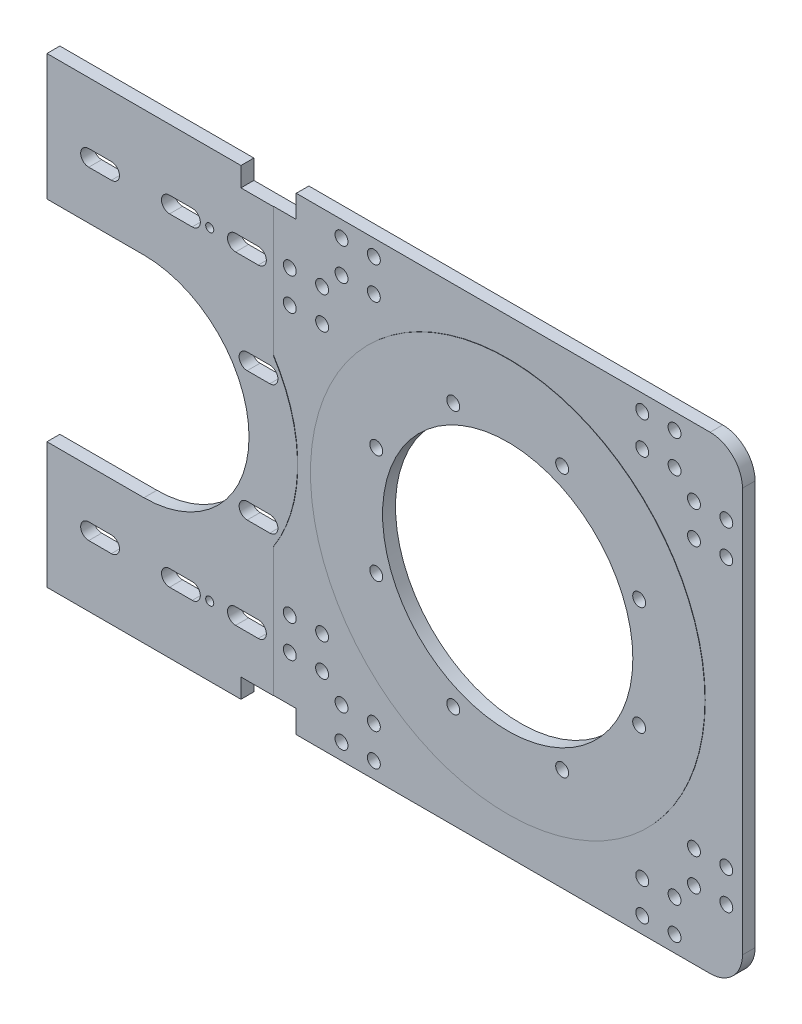
from build123d import *

# Parameters (mm, degrees)
SKETCH_1_W          = 145
SKETCH_1_H          = 145
SKETCH_1_R          = 38.7
SKETCH_1_R_2        = 2
EXTRUDE_1_DEPTH     = 4
SKETCH_2_OUTSIDE_W  = 188.02
SKETCH_2_OUTSIDE_H  = 188.02
SKETCH_2_OUTSIDE_R  = 61
CUT_EXTRUDE_1_DEPTH = 0.1
SKETCH_3_R          = 1.25
EXTRUDE_2_DEPTH     = 4
SKETCH_5_R          = 2
CUT_EXTRUDE_2_DEPTH = 4
SKETCH_7_R          = 47.5
SKETCH_7_W          = 32
SKETCH_7_H          = 7.011387078
SKETCH_7_H_2        = 7
CUT_EXTRUDE_4_DEPTH = 4
SKETCH_8_W          = 15
SKETCH_8_H          = 6
EXTRUDE_3_DEPTH     = 4
FILLET_4_R          = 10
CUT_EXTRUDE_6_DEPTH = 4
EXTRUDE_5_DEPTH     = 4
CUT_EXTRUDE_7_DEPTH = 4
CUT_EXTRUDE_8_DEPTH = 4


with BuildPart() as part:
    # 草图1 → 凸台-拉伸1 (new body)
    with BuildSketch(Plane.XY):
        Rectangle(SKETCH_1_W, SKETCH_1_H)
        Circle(SKETCH_1_R, mode=Mode.SUBTRACT)
        with Locations((16.838071024, 40.65069943)):
            Circle(SKETCH_1_R_2, mode=Mode.SUBTRACT)
        with Locations((40.65069943, 16.838071024)):
            Circle(SKETCH_1_R_2, mode=Mode.SUBTRACT)
        with Locations((40.65069943, -16.838071024)):
            Circle(SKETCH_1_R_2, mode=Mode.SUBTRACT)
        with Locations((16.838071024, -40.65069943)):
            Circle(SKETCH_1_R_2, mode=Mode.SUBTRACT)
        with Locations((-16.838071024, -40.65069943)):
            Circle(SKETCH_1_R_2, mode=Mode.SUBTRACT)
        with Locations((-40.65069943, -16.838071024)):
            Circle(SKETCH_1_R_2, mode=Mode.SUBTRACT)
        with Locations((-40.65069943, 16.838071024)):
            Circle(SKETCH_1_R_2, mode=Mode.SUBTRACT)
        with Locations((-16.838071024, 40.65069943)):
            Circle(SKETCH_1_R_2, mode=Mode.SUBTRACT)
    extrude(amount=EXTRUDE_1_DEPTH)

    # 草图2 outside → 切除-拉伸1 (cut)
    with BuildSketch(Plane.XY.offset(4)):
        Rectangle(SKETCH_2_OUTSIDE_W, SKETCH_2_OUTSIDE_H)
        Circle(SKETCH_2_OUTSIDE_R, mode=Mode.SUBTRACT)
    extrude(amount=-CUT_EXTRUDE_1_DEPTH, mode=Mode.SUBTRACT)

    # 草图3 → 凸台-拉伸2 (add)
    # profile 1 of 2: a face of its own
    with BuildSketch(Plane(origin=(0, 0, 0), x_dir=(-1, 0, 0), z_dir=(0, 0, -1))):
        with BuildLine():
            Line((79.5, -72.5), (97.5, -72.5))
            Line((97.5, -72.5), (97.5, -45.069390943))
            ThreePointArc((97.5, -45.069390943), (83.330748854, -37.488728807), (72.5, -25.617376915))
            Line((72.5, -25.617376915), (72.5, -65.5))
            Line((72.5, -65.5), (79.5, -65.5))
            Line((79.5, -65.5), (79.5, -72.5))
        make_face()
        with Locations((84.154569054, -50)):
            Circle(SKETCH_3_R, mode=Mode.SUBTRACT)
        with Locations((92.154569054, -50)):
            Circle(SKETCH_3_R, mode=Mode.SUBTRACT)
    # profile 2 of 2: a face of its own
    with BuildSketch(Plane(origin=(0, 0, 0), x_dir=(-1, 0, 0), z_dir=(0, 0, -1))):
        with BuildLine():
            ThreePointArc((72.5, 25.617376915), (83.330748854, 37.488728807), (97.5, 45.069390943))
            Line((97.5, 45.069390943), (97.5, 72.5))
            Line((97.5, 72.5), (79.5, 72.5))
            Line((79.5, 72.5), (79.5, 65.5))
            Line((79.5, 65.5), (72.5, 65.5))
            Line((72.5, 65.5), (72.5, 25.617376915))
        make_face()
        with Locations((84.154569054, 50)):
            Circle(SKETCH_3_R, mode=Mode.SUBTRACT)
        with Locations((92.154569054, 50)):
            Circle(SKETCH_3_R, mode=Mode.SUBTRACT)
    extrude(amount=-EXTRUDE_2_DEPTH)

    # 草图5 → 切除-拉伸2 (cut)
    with BuildSketch(Plane(origin=(0, 0, 0), x_dir=(-1, 0, 0), z_dir=(0, 0, -1))):
        with Locations((-67.5, 41.5)):
            Circle(SKETCH_5_R)
        with Locations((-41.5, 67.5)):
            Circle(SKETCH_5_R)
        with Locations((-51.5, 67.5)):
            Circle(SKETCH_5_R)
        with Locations((-51.5, 57.5)):
            Circle(SKETCH_5_R)
        with Locations((-41.5, 57.5)):
            Circle(SKETCH_5_R)
        with Locations((-57.5, 41.5)):
            Circle(SKETCH_5_R)
        with Locations((-57.5, 51.5)):
            Circle(SKETCH_5_R)
        with Locations((-67.5, 51.5)):
            Circle(SKETCH_5_R)
        with Locations(Location((67.5, 51.5, 0), (0, 0, 180))):
            Circle(SKETCH_5_R)
        with Locations(Location((57.5, 51.5, 0), (0, 0, 180))):
            Circle(SKETCH_5_R)
        with Locations(Location((57.5, 41.5, 0), (0, 0, 180))):
            Circle(SKETCH_5_R)
        with Locations(Location((41.5, 57.5, 0), (0, 0, 180))):
            Circle(SKETCH_5_R)
        with Locations(Location((51.5, 57.5, 0), (0, 0, 180))):
            Circle(SKETCH_5_R)
        with Locations(Location((51.5, 67.5, 0), (0, 0, 180))):
            Circle(SKETCH_5_R)
        with Locations(Location((41.5, 67.5, 0), (0, 0, 180))):
            Circle(SKETCH_5_R)
        with Locations(Location((67.5, 41.5, 0), (0, 0, 180))):
            Circle(SKETCH_5_R)
        with Locations((67.5, -41.5)):
            Circle(SKETCH_5_R)
        with Locations((41.5, -67.5)):
            Circle(SKETCH_5_R)
        with Locations((51.5, -67.5)):
            Circle(SKETCH_5_R)
        with Locations((51.5, -57.5)):
            Circle(SKETCH_5_R)
        with Locations((41.5, -57.5)):
            Circle(SKETCH_5_R)
        with Locations((57.5, -41.5)):
            Circle(SKETCH_5_R)
        with Locations((57.5, -51.5)):
            Circle(SKETCH_5_R)
        with Locations((67.5, -51.5)):
            Circle(SKETCH_5_R)
        with Locations(Location((-67.5, -51.5, 0), (0, 0, 180))):
            Circle(SKETCH_5_R)
        with Locations(Location((-57.5, -51.5, 0), (0, 0, 180))):
            Circle(SKETCH_5_R)
        with Locations(Location((-57.5, -41.5, 0), (0, 0, 180))):
            Circle(SKETCH_5_R)
        with Locations(Location((-41.5, -57.5, 0), (0, 0, 180))):
            Circle(SKETCH_5_R)
        with Locations(Location((-51.5, -57.5, 0), (0, 0, 180))):
            Circle(SKETCH_5_R)
        with Locations(Location((-51.5, -67.5, 0), (0, 0, 180))):
            Circle(SKETCH_5_R)
        with Locations(Location((-41.5, -67.5, 0), (0, 0, 180))):
            Circle(SKETCH_5_R)
        with Locations(Location((-67.5, -41.5, 0), (0, 0, 180))):
            Circle(SKETCH_5_R)
    extrude(amount=-CUT_EXTRUDE_2_DEPTH, mode=Mode.SUBTRACT)

    # 草图7 → 切除-拉伸4 (cut)
    with BuildSketch(Plane(origin=(0, 0, 0), x_dir=(-1, 0, 0), z_dir=(0, 0, -1))):
        with Locations((112.5, 0)):
            Circle(SKETCH_7_R)
        with Locations((81.5, 68.994306461)):
            Rectangle(SKETCH_7_W, SKETCH_7_H)
        with Locations((81.5, -69)):
            Rectangle(SKETCH_7_W, SKETCH_7_H_2)
    extrude(amount=-CUT_EXTRUDE_4_DEPTH, mode=Mode.SUBTRACT)

    # 草图8 → 凸台-拉伸3 (add)
    with BuildSketch(Plane(origin=(0, 0, 0), x_dir=(-1, 0, 0), z_dir=(0, 0, -1))):
        with Locations((90, 68.488612922)):
            Rectangle(SKETCH_8_W, SKETCH_8_H)
    extrude_3 = extrude(amount=-EXTRUDE_3_DEPTH)

    # 镜向1: 凸台-拉伸3 across plane
    add(extrude_3.mirror(Plane.ZX))

    # 圆角4
    fillet_4_edges = [part.edges().sort_by_distance(p)[0] for p in [
        (72.5, -72.5, 1.95),
        (72.5, 72.5, 1.95),
    ]]
    fillet(fillet_4_edges, radius=FILLET_4_R)

    # 草图12 → 切除-拉伸6 (cut)
    with BuildSketch(Plane(origin=(0, 0, 0), x_dir=(-1, 0, 0), z_dir=(0, 0, -1))):
        with BuildLine():
            Line((84.154569054, 47.5), (77.154569054, 47.5))
            ThreePointArc((77.154569054, 47.5), (74.654569054, 50), (77.154569054, 52.5))
            Line((77.154569054, 52.5), (84.154569054, 52.5))
            ThreePointArc((84.154569054, 52.5), (86.654569054, 50), (84.154569054, 47.5))
        make_face()
        with BuildLine():
            Line((84.154569054, -52.5), (77.154569054, -52.5))
            ThreePointArc((77.154569054, -52.5), (74.654569054, -50), (77.154569054, -47.5))
            Line((77.154569054, -47.5), (84.154569054, -47.5))
            ThreePointArc((84.154569054, -47.5), (86.654569054, -50), (84.154569054, -52.5))
        make_face()
    extrude(amount=-CUT_EXTRUDE_6_DEPTH, mode=Mode.SUBTRACT)

    # 草图13 → 凸台-拉伸5 (add)
    with BuildSketch(Plane(origin=(0, 0, 0), x_dir=(-1, 0, 0), z_dir=(0, 0, -1))):
        with BuildLine():
            Line((97.5, -71.488612922), (142.5, -71.488612922))
            Line((142.5, -71.488612922), (142.5, -32.5))
            Line((142.5, -32.5), (112.5, -32.5))
            ThreePointArc((112.5, -32.5), (80, 0), (112.5, 32.5))
            Line((112.5, 32.5), (142.5, 32.5))
            Line((142.5, 32.5), (142.5, 71.488612922))
            Line((142.5, 71.488612922), (97.5, 71.488612922))
            Line((97.5, 71.488612922), (97.5, 45.069390943))
            ThreePointArc((97.5, 45.069390943), (65, 0), (97.5, -45.069390943))
            Line((97.5, -45.069390943), (97.5, -71.488612922))
        make_face()
    extrude(amount=-EXTRUDE_5_DEPTH)

    # 草图14 → 切除-拉伸7 (cut)
    with BuildSketch(Plane(origin=(0, 0, 0), x_dir=(-1, 0, 0), z_dir=(0, 0, -1))):
        with BuildLine():
            Line((97.566987559, 52.5), (104.566987559, 52.5))
            ThreePointArc((104.566987559, 52.5), (107.066987559, 50), (104.566987559, 47.5))
            Line((104.566987559, 47.5), (97.566987559, 47.5))
            ThreePointArc((97.566987559, 47.5), (95.066987559, 50), (97.566987559, 52.5))
        make_face()
        with BuildLine():
            Line((122.566987559, 52.5), (129.566987559, 52.5))
            ThreePointArc((129.566987559, 52.5), (132.066987559, 50), (129.566987559, 47.5))
            Line((129.566987559, 47.5), (122.566987559, 47.5))
            ThreePointArc((122.566987559, 47.5), (120.066987559, 50), (122.566987559, 52.5))
        make_face()
        with BuildLine():
            Line((122.566987559, -52.5), (129.566987559, -52.5))
            ThreePointArc((129.566987559, -52.5), (132.066987559, -50), (129.566987559, -47.5))
            Line((129.566987559, -47.5), (122.566987559, -47.5))
            ThreePointArc((122.566987559, -47.5), (120.066987559, -50), (122.566987559, -52.5))
        make_face()
        with BuildLine():
            Line((97.566987559, -52.5), (104.566987559, -52.5))
            ThreePointArc((104.566987559, -52.5), (107.066987559, -50), (104.566987559, -47.5))
            Line((104.566987559, -47.5), (97.566987559, -47.5))
            ThreePointArc((97.566987559, -47.5), (95.066987559, -50), (97.566987559, -52.5))
        make_face()
    extrude(amount=-CUT_EXTRUDE_7_DEPTH, mode=Mode.SUBTRACT)

    # 草图16 → 切除-拉伸8 (cut)
    with BuildSketch(Plane(origin=(0, 0, 0), x_dir=(-1, 0, 0), z_dir=(0, 0, -1))):
        with BuildLine():
            Line((73.566987559, 22.5), (80.566987559, 22.5))
            ThreePointArc((80.566987559, 22.5), (83.066987559, 20), (80.566987559, 17.5))
            Line((80.566987559, 17.5), (73.566987559, 17.5))
            ThreePointArc((73.566987559, 17.5), (71.066987559, 20), (73.566987559, 22.5))
        make_face()
        with BuildLine():
            Line((73.566987559, -22.5), (80.566987559, -22.5))
            ThreePointArc((80.566987559, -22.5), (83.066987559, -20), (80.566987559, -17.5))
            Line((80.566987559, -17.5), (73.566987559, -17.5))
            ThreePointArc((73.566987559, -17.5), (71.066987559, -20), (73.566987559, -22.5))
        make_face()
    extrude(amount=-CUT_EXTRUDE_8_DEPTH, mode=Mode.SUBTRACT)


solid = part.part
